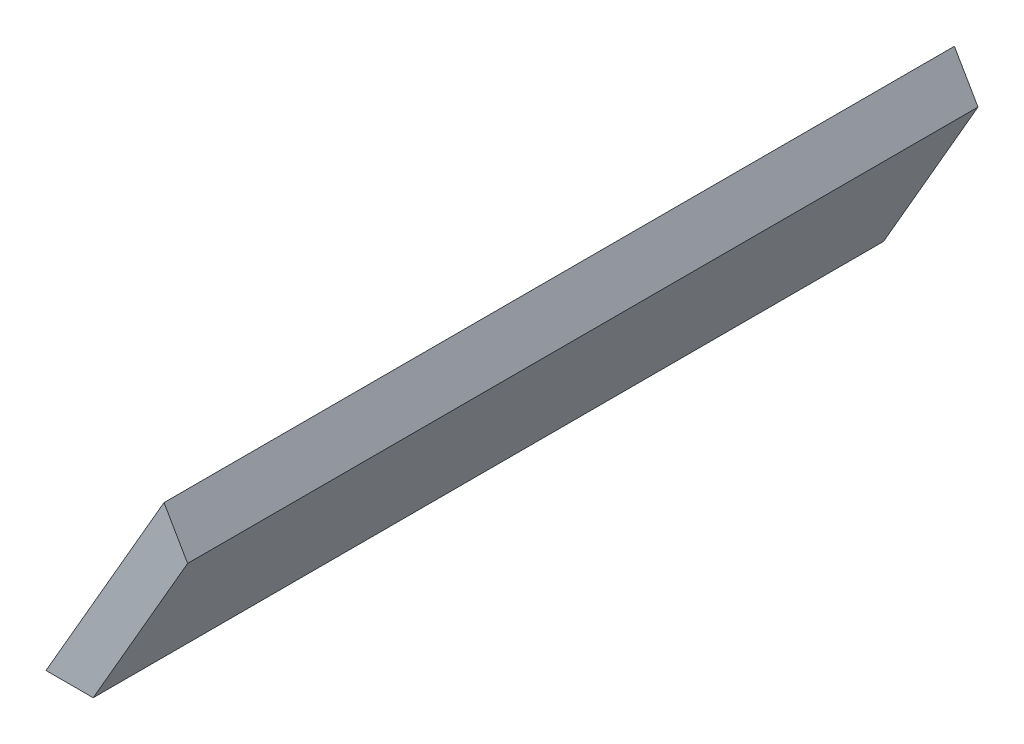
from build123d import *

# Parameters (mm, degrees)
BOSS_EXTRU_1_DEPTH      = 580
ESQUISSE2_R             = 100
ESQUISSE2_R_2           = 31.5
ENL_V_MAT_EXTRU_1_DEPTH = 150


with BuildPart() as part:
    # Esquisse1 → Boss.-Extru.1 (new body)
    with BuildSketch(Plane.XY):
        Polygon((17.318475684, 0), (0, 30), (-86.592378418, -120), (-51.955427051, -120), align=None)
    extrude(amount=BOSS_EXTRU_1_DEPTH)

    # Esquisse2 → Enlèv. mat.-Extru.1 (cut)
    with BuildSketch(Plane(origin=(0, 30, 0), x_dir=(1, 0, 0), z_dir=(0, 1, 0))):
        with Locations((118.403810791, -290)):
            Circle(ESQUISSE2_R)
        with Locations((118.403810791, -100)):
            Circle(ESQUISSE2_R_2)
    extrude(amount=-ENL_V_MAT_EXTRU_1_DEPTH, mode=Mode.SUBTRACT)


solid = part.part
